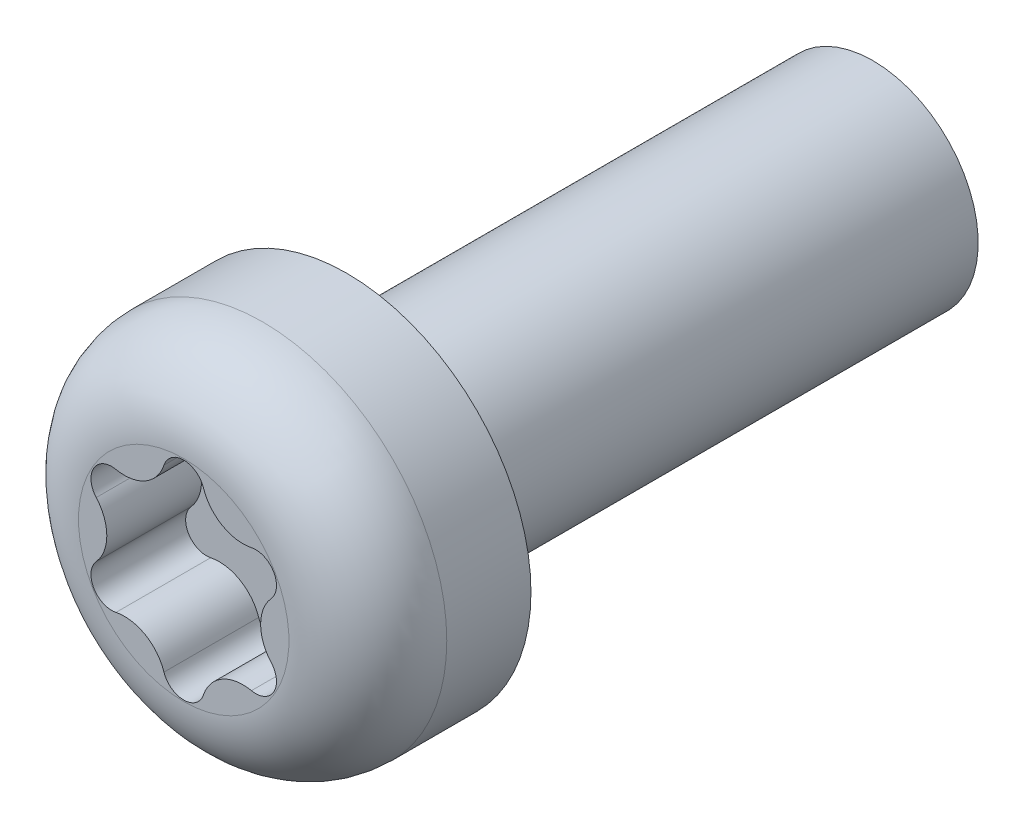
from build123d import *

# Parameters (mm, degrees)
CUT_EXTRUDE1_DEPTH = 1.8
CIRPATTERN1_COUNT  = 6


with BuildPart() as part:
    # Sketch1 → Revolve1 (revolve)
    with BuildSketch(Plane(origin=(0, 0, 0), x_dir=(0, 0, -1), z_dir=(1, 0, 0))):
        with BuildLine():
            Line((-3.1, 0), (-3.1, 2))
            ThreePointArc((-3.1, 2), (-2.660660172, 3.060660172), (-1.6, 3.5))
            Line((-1.6, 3.5), (0, 3.5))
            Line((0, 3.5), (0, 2))
            Line((0, 2), (10, 2))
            Line((10, 2), (10, 0))
            Line((10, 0), (-3.1, 0))
        make_face()
    revolve(axis=Axis((0, 0, 5.584882278), (0, 0, -1)))

    # Sketch2 → Cut-Extrude1 (cut)
    with BuildSketch(Plane.XY.offset(3.1)):
        with BuildLine():
            Line((-0.730783495, 1.265754142), (0, 0))
            Line((0, 0), (0.730783495, 1.265754142))
            ThreePointArc((0.730783495, 1.265754142), (0.512661987, 1.451735511), (0.375261165, 1.703304737))
            ThreePointArc((0.375261165, 1.703304737), (0, 1.975), (-0.375261165, 1.703304737))
            ThreePointArc((-0.375261165, 1.703304737), (-0.512661987, 1.451735511), (-0.730783495, 1.265754142))
        make_face()
    cut_extrude1 = extrude(amount=-CUT_EXTRUDE1_DEPTH, mode=Mode.SUBTRACT)

    # CirPattern1: Cut-Extrude1 ×6 about axis
    cirpattern1_axis = Axis((0, 0, 5.584882278), (0, 0, 1))
    for i in range(1, CIRPATTERN1_COUNT):
        add(cut_extrude1.rotate(cirpattern1_axis, i * 360 / CIRPATTERN1_COUNT), mode=Mode.SUBTRACT)


solid = part.part
